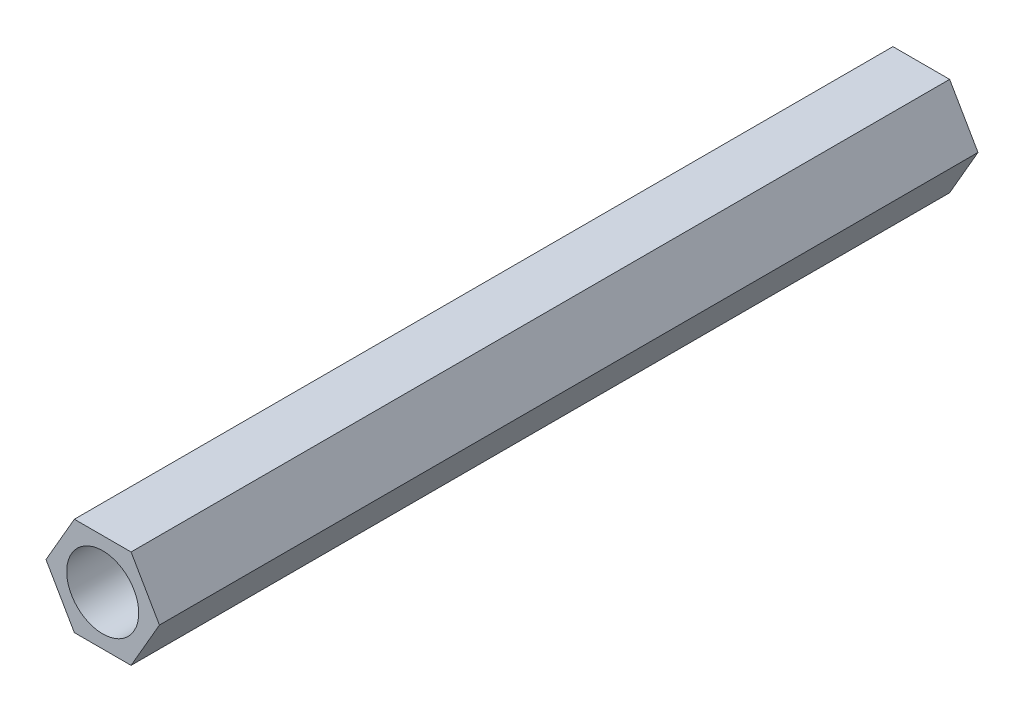
from build123d import *

# Parameters (mm, degrees)
EXTRUDE_1_DEPTH     = 25
SKETCH_2_R          = 1.1
CUT_EXTRUDE_1_DEPTH = 3
CUT_EXTRUDE_START   = -3
SKETCH_3_R          = 1.1
CUT_EXTRUDE_2_DEPTH = 3


with BuildPart() as part:
    # 草图1 → 凸台-拉伸1 (new body)
    with BuildSketch(Plane.XY):
        Polygon((1.732050808, 0), (0.866025404, 1.5), (-0.866025404, 1.5), (-1.732050808, 0), (-0.866025404, -1.5), (0.866025404, -1.5), align=None)
    extrude(amount=EXTRUDE_1_DEPTH)

    # 草图2 → 切除-拉伸1 (cut)
    with BuildSketch(Plane.XY.offset(25)):
        Circle(SKETCH_2_R)
    extrude(amount=-CUT_EXTRUDE_1_DEPTH, mode=Mode.SUBTRACT)

    # 草图3 → 切除-拉伸2 (cut)
    with BuildSketch(Plane(origin=(0, 0, 0), x_dir=(-1, 0, 0), z_dir=(0, 0, -1)).offset(CUT_EXTRUDE_START)):
        with Locations(Location((0, 0, 0), (0, 0, 180))):
            Circle(SKETCH_3_R)
    extrude(amount=CUT_EXTRUDE_2_DEPTH, mode=Mode.SUBTRACT)


solid = part.part
